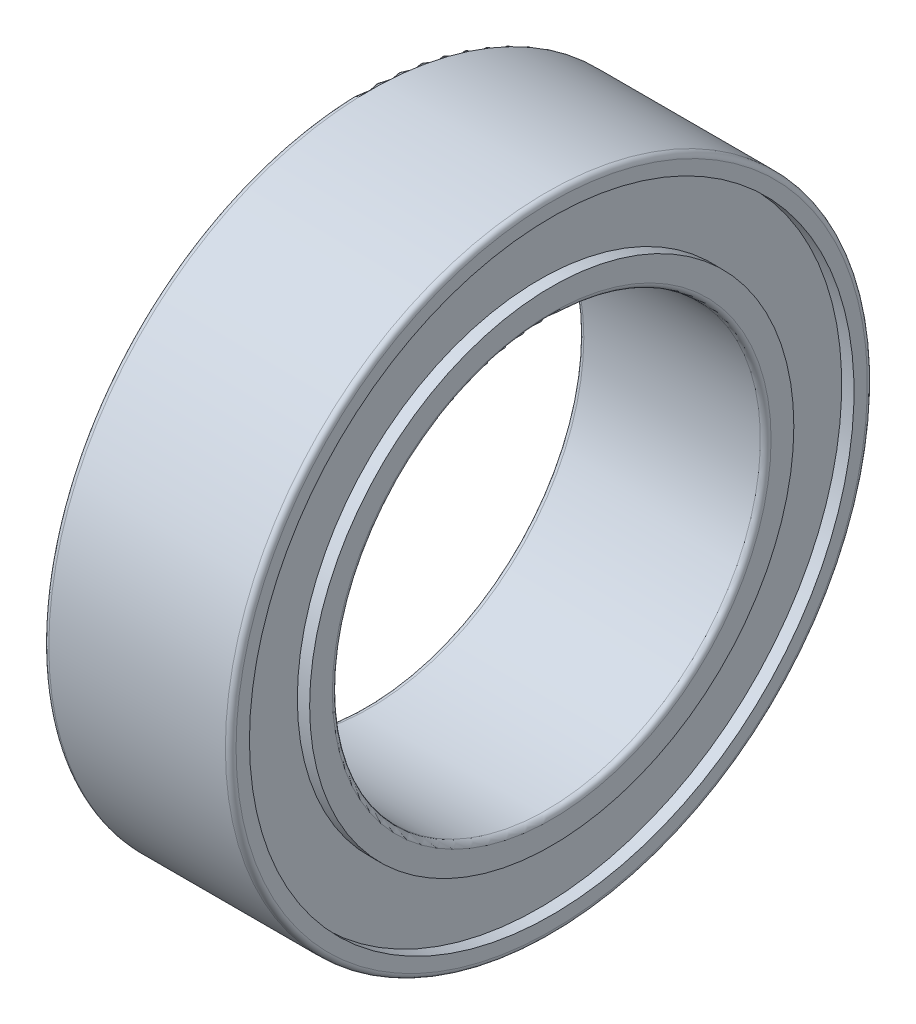
from build123d import *

# Parameters (mm, degrees)
FILLET1_R = 0.1
FILLET2_R = 0.1


with BuildPart() as part:
    # Sketch1 → Revolve1 (revolve)
    with BuildSketch(Plane.XY, mode=Mode.PRIVATE) as revolve1_sk:
        Polygon((0, 4), (3.5, 4), (3.5, 4.525), (3.27, 4.525), (3.27, 5.65), (3.5, 5.65), (3.5, 6), (0, 6), (0, 5.65), (0.23, 5.65), (0.23, 4.525), (0, 4.525), align=None)
    revolve(revolve1_sk.sketch.rotate(Axis((0, 0, 0), (1, 0, 0)), 90), axis=Axis((0, 0, 0), (1, 0, 0)))

    # Fillet1
    fillet1_edges = [part.edges().sort_by_distance(p)[0] for p in [
        (0, 0, -6),
        (3.5, 0, -6),
    ]]
    fillet(fillet1_edges, radius=FILLET1_R)

    # Fillet2
    fillet2_edges = [part.edges().sort_by_distance(p)[0] for p in [
        (3.5, 0, -4),
        (0, 0, -4),
    ]]
    fillet(fillet2_edges, radius=FILLET2_R)


solid = part.part
